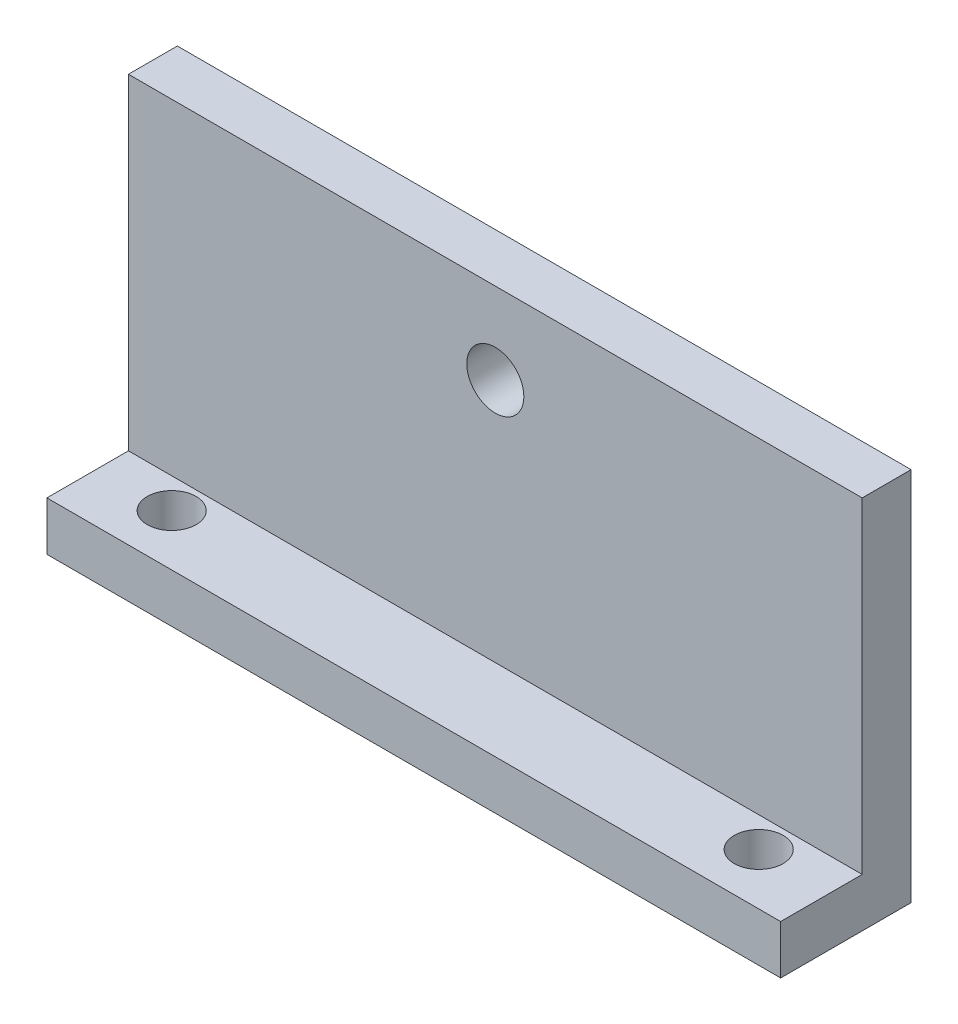
from build123d import *

# Parameters (mm, degrees)
ESQUISSE1_W             = 45
ESQUISSE1_H             = 8
ESQUISSE1_R             = 1.5
BOSS_EXTRU_1_DEPTH      = 3
ESQUISSE2_W             = 45
ESQUISSE2_H             = 3
BOSS_EXTRU_2_DEPTH      = 20
ESQUISSE3_R             = 1.75
ENL_V_MAT_EXTRU_1_DEPTH = 20


with BuildPart() as part:
    # Esquisse1 → Boss.-Extru.1 (new body)
    with BuildSketch(Plane(origin=(0, 0, 0), x_dir=(1, 0, 0), z_dir=(0, 1, 0))):
        with Locations((1.515789474, 0.846662995)):
            Rectangle(ESQUISSE1_W, ESQUISSE1_H)
        with Locations(Location((19.515789474, 0, 0), (0, 0, 270))):
            Circle(ESQUISSE1_R, mode=Mode.SUBTRACT)
        with Locations(Location((-16.484210526, 0, 0), (0, 0, 270))):
            Circle(ESQUISSE1_R, mode=Mode.SUBTRACT)
    extrude(amount=BOSS_EXTRU_1_DEPTH)

    # Esquisse2 → Boss.-Extru.2 (add)
    with BuildSketch(Plane(origin=(0, 3, 0), x_dir=(1, 0, 0), z_dir=(0, 1, 0))):
        with Locations((1.515789474, 3.346662995)):
            Rectangle(ESQUISSE2_W, ESQUISSE2_H)
    extrude(amount=BOSS_EXTRU_2_DEPTH)

    # Esquisse3 → Enlèv. mat.-Extru.1 (cut)
    with BuildSketch(Plane.XY.offset(-1.846662995)):
        with Locations((1.515789474, 18)):
            Circle(ESQUISSE3_R)
    extrude(amount=-ENL_V_MAT_EXTRU_1_DEPTH, mode=Mode.SUBTRACT)


solid = part.part
